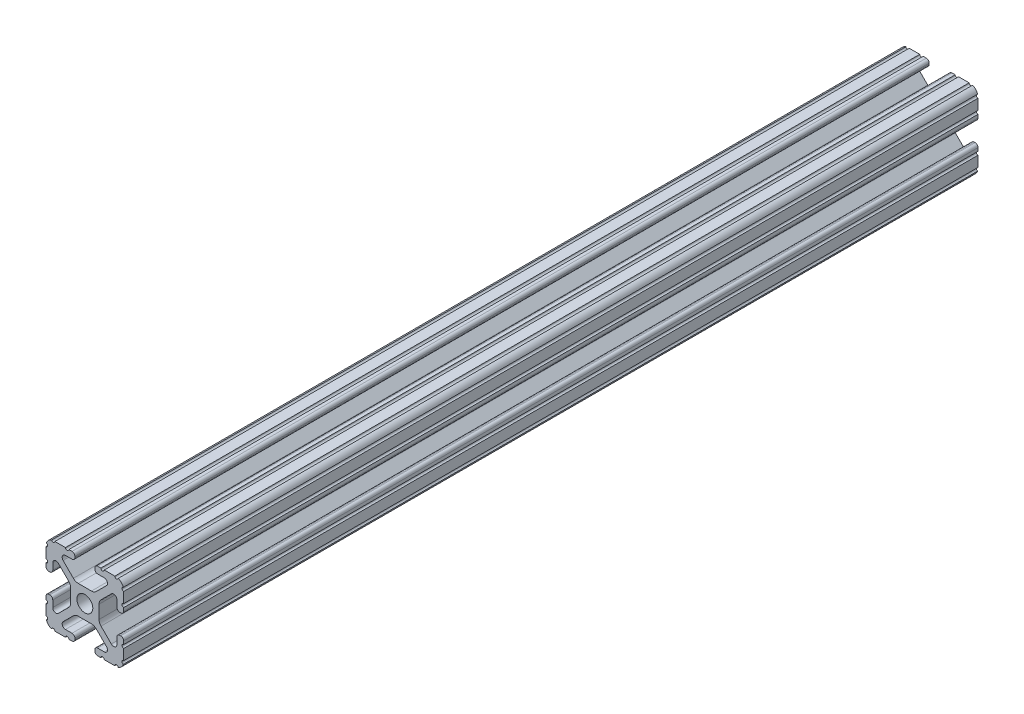
from build123d import *

# Parameters (mm, degrees)
BOSS_EXTRUDE1_DEPTH     = 1524
CUT_EXTRUDE1_DEPTH      = 1525.105829659
CUT_EXTRUDE1_DEPTH_BACK = 1525.105829659
SKETCH5_R               = 0.55245
CUT_EXTRUDE2_DEPTH      = 1525.105829659
CUT_EXTRUDE2_DEPTH_BACK = 1525.105829659
SKETCH8_W               = 50.559993734
SKETCH8_H               = 2781.3


with BuildPart() as part:
    # Sketch4 → Boss-Extrude1 (new, symmetric)
    with BuildSketch(Plane.XY):
        with BuildLine():
            Line((4.190365, -12.7), (10.11729625, -12.7))
            ThreePointArc((10.11729625, -12.7), (11.943543585, -11.943543585), (12.7, -10.11729625))
            Line((12.7, -10.11729625), (12.7, -4.190365))
            ThreePointArc((12.7, -4.190365), (12.42492494, -3.52627506), (11.760835, -3.2512))
            Line((11.760835, -3.2512), (11.429365, -3.2512))
            ThreePointArc((11.429365, -3.2512), (10.76527506, -3.52627506), (10.4902, -4.190365))
            Line((10.4902, -4.190365), (10.4902, -6.348478019))
            ThreePointArc((10.4902, -6.348478019), (9.830707141, -7.335478831), (8.666460301, -7.103895736))
            Line((8.666460301, -7.103895736), (5.299899128, -3.737334563))
            ThreePointArc((5.299899128, -3.737334563), (4.817571085, -3.015479634), (4.6482, -2.16399369))
            Line((4.6482, -2.16399369), (4.6482, 0))
            Line((4.6482, 0), (2.6035, 0))
            ThreePointArc((2.6035, 0), (1.840952505, -1.840952505), (0, -2.6035))
            Line((0, -2.6035), (0, -4.6482))
            Line((0, -4.6482), (2.16399369, -4.6482))
            ThreePointArc((2.16399369, -4.6482), (3.015479634, -4.817571085), (3.737334563, -5.299899128))
            Line((3.737334563, -5.299899128), (7.103895736, -8.666460301))
            ThreePointArc((7.103895736, -8.666460301), (7.335478831, -9.830707141), (6.348478019, -10.4902))
            Line((6.348478019, -10.4902), (4.190365, -10.4902))
            ThreePointArc((4.190365, -10.4902), (3.52627506, -10.76527506), (3.2512, -11.429365))
            Line((3.2512, -11.429365), (3.2512, -11.760835))
            ThreePointArc((3.2512, -11.760835), (3.52627506, -12.42492494), (4.190365, -12.7))
        make_face()
    extrude(amount=BOSS_EXTRUDE1_DEPTH, both=True)

    # Sketch5 → Cut-Extrude1 (cut, two sides: drawn at the far end of the back side and taken through both)
    with BuildSketch(Plane.XY.offset(-CUT_EXTRUDE1_DEPTH_BACK)):
        with Locations((10.356153152, -12.7)):
            Circle(SKETCH5_R)
        with Locations((5.796028019, -12.7)):
            Circle(SKETCH5_R)
        with Locations((12.7, -10.356153152)):
            Circle(SKETCH5_R)
        with Locations((12.7, -5.796028019)):
            Circle(SKETCH5_R)
    extrude(amount=CUT_EXTRUDE1_DEPTH + CUT_EXTRUDE1_DEPTH_BACK, mode=Mode.SUBTRACT)

    # Mirror1: part across plane


with BuildPart() as part_1:
    add(part.part)
    add(part.part.mirror(Plane(origin=(0, 0, 0), x_dir=(0, 0, 1), z_dir=(1, 0, 0))))

    # Mirror2: part across plane


with BuildPart() as part_2:
    add(part_1.part)
    add(part_1.part.mirror(Plane.ZX))

    # Sketch8 → Cut-Extrude2 (cut, two sides: drawn at the far end of the back side and taken through both)
    with BuildSketch(Plane(origin=(0, 0, 0), x_dir=(1, 0, 0), z_dir=(0, 1, 0)).offset(-CUT_EXTRUDE2_DEPTH_BACK)):
        with Locations((0, 146.05)):
            Rectangle(SKETCH8_W, SKETCH8_H)
    extrude(amount=CUT_EXTRUDE2_DEPTH + CUT_EXTRUDE2_DEPTH_BACK, mode=Mode.SUBTRACT)


solid = part_2.part
